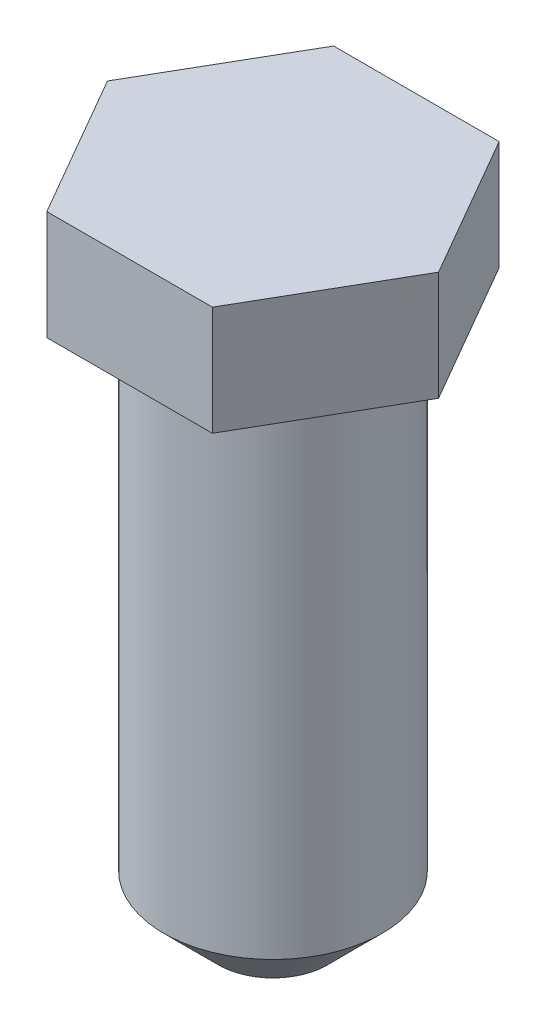
from build123d import *

# Parameters (mm, degrees)
BOSS_EXTRUDE2_DEPTH = 12.7
SKETCH6_R           = 12.7
BOSS_EXTRUDE3_DEPTH = 57.15
SKETCH10_R          = 12.7
BOSS_EXTRUDE5_DEPTH = 6.35
CHAMFER2_SIZE       = 6.35


with BuildPart() as part:
    # Sketch5 → Boss-Extrude2 (new body)
    with BuildSketch(Plane(origin=(0, 0, 0), x_dir=(1, 0, 0), z_dir=(0, 1, 0))):
        Polygon((19.247414599, 0), (9.6237073, 16.66875), (-9.6237073, 16.66875), (-19.247414599, 0), (-9.6237073, -16.66875), (9.6237073, -16.66875), align=None)
    extrude(amount=BOSS_EXTRUDE2_DEPTH)

    # Sketch6 → Boss-Extrude3 (add)
    with BuildSketch(Plane.XZ):
        with Locations(Location((0, 0, 0), (0, 0, 270))):
            Circle(SKETCH6_R)
    extrude(amount=BOSS_EXTRUDE3_DEPTH)

    # Sketch10 → Boss-Extrude5 (add)
    with BuildSketch(Plane.XZ.offset(57.15)):
        with Locations(Location((0, 0, 0), (0, 0, 270))):
            Circle(SKETCH10_R)
    extrude(amount=BOSS_EXTRUDE5_DEPTH)

    # Chamfer2
    chamfer2_edges = [part.edges().sort_by_distance(p)[0] for p in [
        (0, -63.5, 12.7),
    ]]
    chamfer(chamfer2_edges, length=CHAMFER2_SIZE)


solid = part.part
